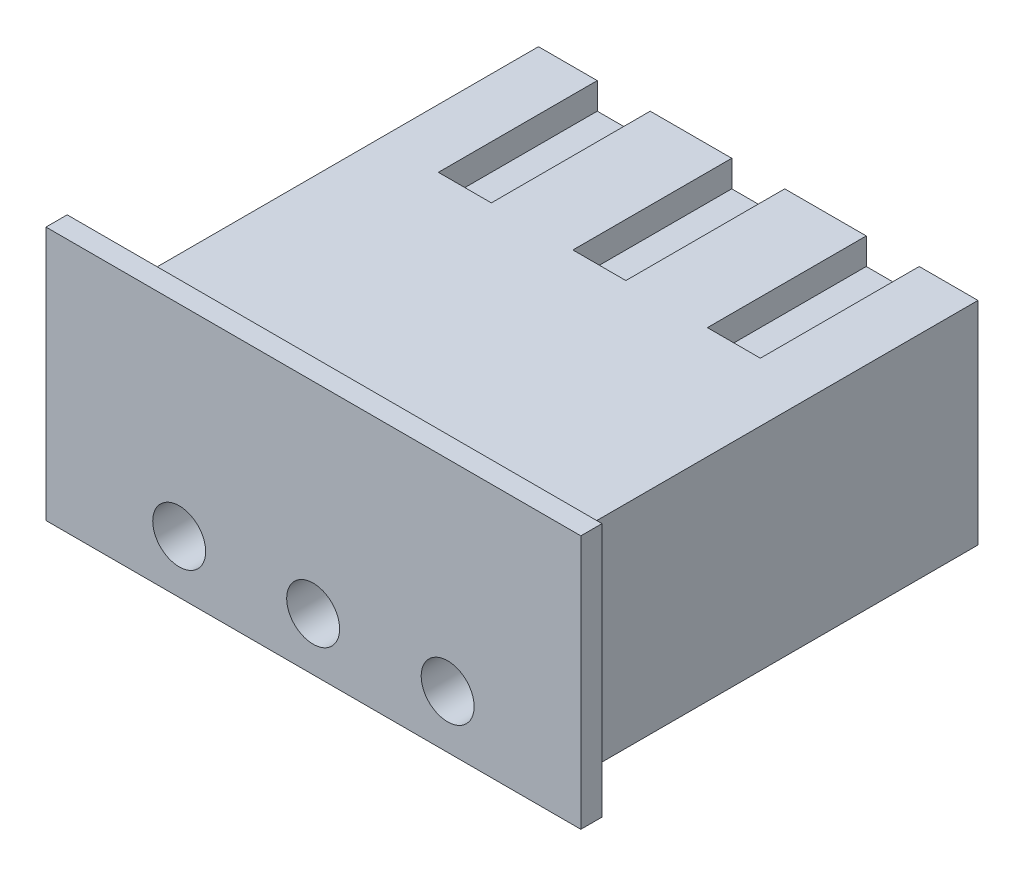
from build123d import *

# Parameters (mm, degrees)
SKETCH_2_W               = 8.3
SKETCH_2_H               = 4
EXTRUDE_1_DEPTH          = 8
SKETCH_3_W               = 10.1
SKETCH_3_H               = 4.8
EXTRUDE_2_DEPTH          = 0.4
CUT_EXTRUDE_1_DEPTH      = 14.350655415
CUT_EXTRUDE_1_DEPTH_BACK = 3
SKETCH_4_W               = 1
SKETCH_4_H               = 0.5
SKETCH_5_R               = 0.5
CUT_EXTRUDE_2_DEPTH      = 10


with BuildPart() as part:
    # 草图2 → 凸台-拉伸1 (new body)
    with BuildSketch(Plane.XY):
        with Locations((4.15, 2)):
            Rectangle(SKETCH_2_W, SKETCH_2_H)
    extrude(amount=EXTRUDE_1_DEPTH)

    # 草图3 → 凸台-拉伸2 (add)
    with BuildSketch(Plane.XY.offset(8)):
        with Locations((4.15, 2.4)):
            Rectangle(SKETCH_3_W, SKETCH_3_H)
    extrude(amount=EXTRUDE_2_DEPTH)

    # 草图4 → 切除-拉伸1 (cut, two sides: drawn at the far end of the back side and taken through both)
    with BuildSketch(Plane(origin=(0, 0, 0), x_dir=(-1, 0, 0), z_dir=(0, 0, -1)).offset(-CUT_EXTRUDE_1_DEPTH_BACK)):
        with Locations((-4.15, 3.75)):
            Rectangle(SKETCH_4_W, SKETCH_4_H)
        with Locations((-6.69, 3.75)):
            Rectangle(SKETCH_4_W, SKETCH_4_H)
        with Locations((-1.61, 3.75)):
            Rectangle(SKETCH_4_W, SKETCH_4_H)
    extrude(amount=CUT_EXTRUDE_1_DEPTH + CUT_EXTRUDE_1_DEPTH_BACK, mode=Mode.SUBTRACT)

    # 草图5 → 切除-拉伸2 (cut)
    with BuildSketch(Plane(origin=(0, 0, 0), x_dir=(-1, 0, 0), z_dir=(0, 0, -1))):
        with Locations((-6.684838564, 1)):
            Circle(SKETCH_5_R)
        with Locations((-4.144838564, 1)):
            Circle(SKETCH_5_R)
        with Locations((-1.615161436, 1)):
            Circle(SKETCH_5_R)
    extrude(amount=-CUT_EXTRUDE_2_DEPTH, mode=Mode.SUBTRACT)


solid = part.part
